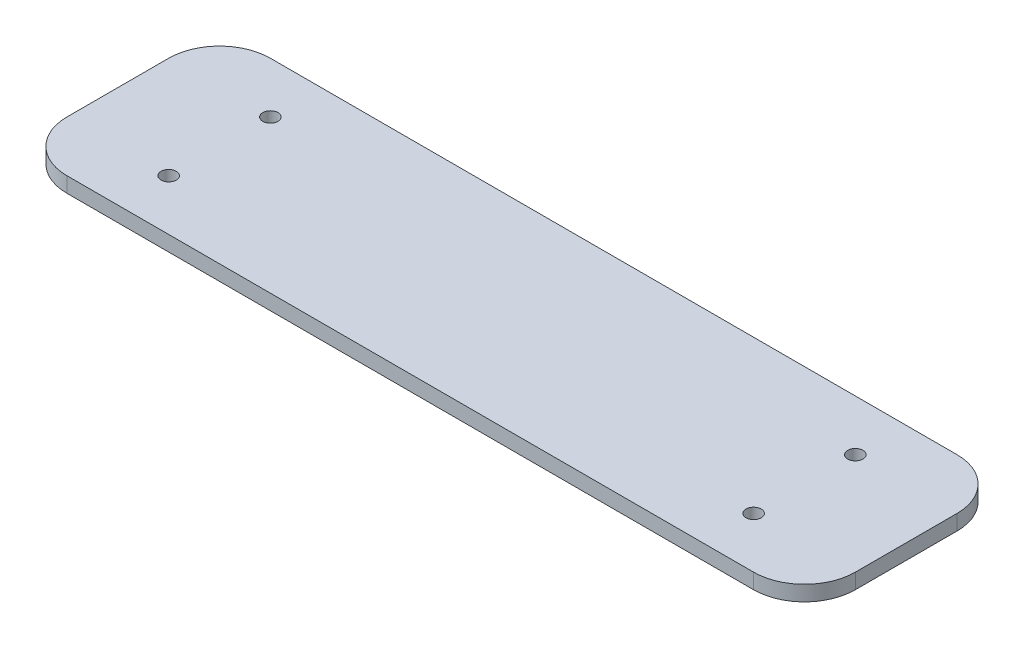
from build123d import *

# Parameters (mm, degrees)
SKETCH_1_W      = 155
SKETCH_1_H      = 40
SKETCH_1_R      = 1.5
EXTRUDE_1_DEPTH = 3
FILLET_1_R      = 10


with BuildPart() as part:
    # 草圖1 → 填料-伸長1 (new body)
    with BuildSketch(Plane(origin=(0, 0, 0), x_dir=(1, 0, 0), z_dir=(0, 1, 0))):
        Rectangle(SKETCH_1_W, SKETCH_1_H)
        with Locations(Location((-57.5, 10, 0), (0, 0, 270))):
            Circle(SKETCH_1_R, mode=Mode.SUBTRACT)
        with Locations(Location((-57.5, -10, 0), (0, 0, 270))):
            Circle(SKETCH_1_R, mode=Mode.SUBTRACT)
        with Locations(Location((57.5, -10, 0), (0, 0, 270))):
            Circle(SKETCH_1_R, mode=Mode.SUBTRACT)
        with Locations(Location((57.5, 10, 0), (0, 0, 270))):
            Circle(SKETCH_1_R, mode=Mode.SUBTRACT)
    extrude(amount=EXTRUDE_1_DEPTH)

    # 圓角1
    fillet_1_edges = [part.edges().sort_by_distance(p)[0] for p in [
        (77.5, 1.5, 20),
        (-77.5, 1.5, 20),
        (-77.5, 1.5, -20),
        (77.5, 1.5, -20),
    ]]
    fillet(fillet_1_edges, radius=FILLET_1_R)


solid = part.part
